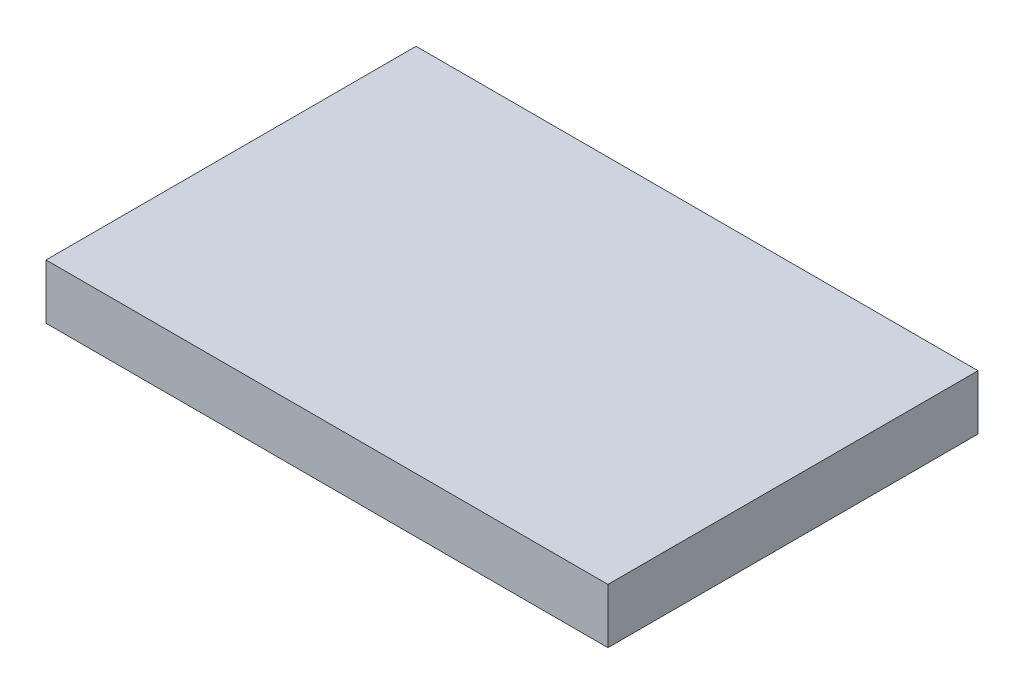
from build123d import *

# Parameters (mm, degrees)
SKETCH1_W           = 82
SKETCH1_H           = 54
BOSS_EXTRUDE1_DEPTH = 8


with BuildPart() as part:
    # Sketch1 → Boss-Extrude1 (new body)
    with BuildSketch(Plane(origin=(0, 0, 0), x_dir=(1, 0, 0), z_dir=(0, 1, 0))):
        Rectangle(SKETCH1_W, SKETCH1_H)
    extrude(amount=BOSS_EXTRUDE1_DEPTH)


solid = part.part
